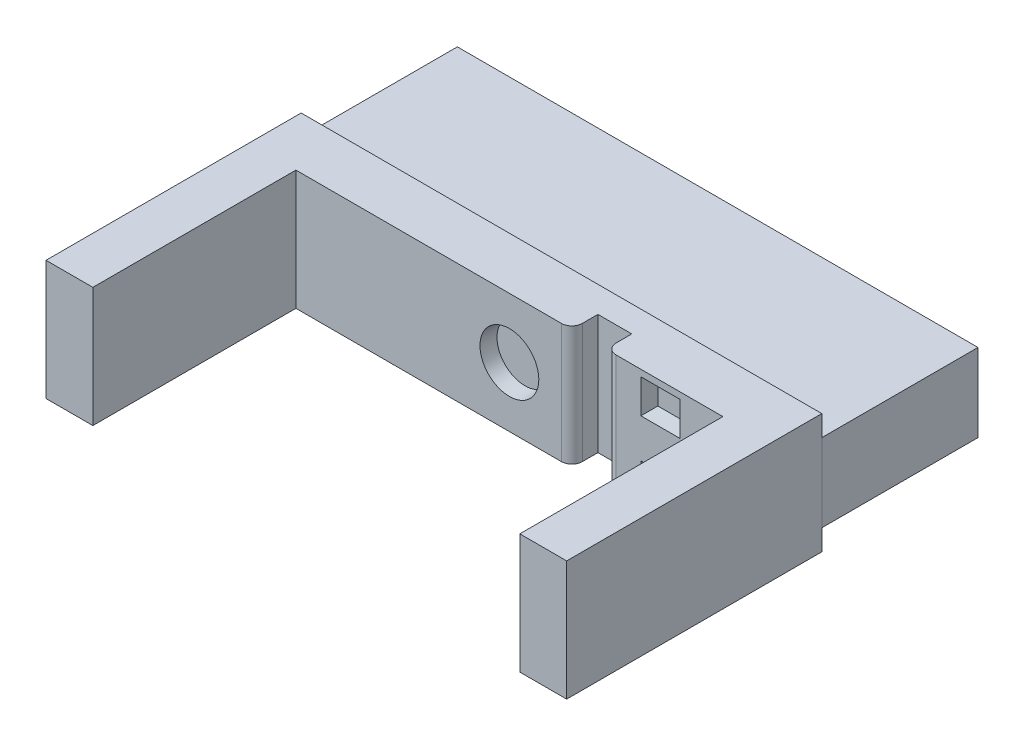
from build123d import *

# Parameters (mm, degrees)
SKETCH1_W                 = 100
SKETCH1_H                 = 15
CARRIAGE_BOTTOM_DEPTH     = 30
SKETCH2_W                 = 100
SKETCH2_H                 = 23
PLEXI_STAND_DEPTH         = 10
SKETCH8_W                 = 6.5
SKETCH8_H                 = 23
HOLE_FOR_WIRES_DEPTH      = 5
FILLET1_R                 = 2
SKETCH9_W                 = 9
SKETCH9_H                 = 23
BRACKET_HOLDERS_DEPTH     = 39
SKETCH10_R                = 5.65
FIT_HOLES_DEPTH           = 3
FIT_HOLES_DRAFT           = -5
SKETCH10_W                = 7.5
SKETCH10_H                = 6.5
FIT_HOLES_PROFILE_2_DEPTH = 3
FIT_HOLES_PROFILE_2_DRAFT = -5
FIT_HOLES_PROFILE_3_DEPTH = 3
FIT_HOLES_PROFILE_3_DRAFT = -5


with BuildPart() as part:
    # Sketch1 → carriage bottom (new body)
    with BuildSketch(Plane.XY):
        with Locations((50, -7.5)):
            Rectangle(SKETCH1_W, SKETCH1_H)
    extrude(amount=CARRIAGE_BOTTOM_DEPTH)


with BuildPart() as body_2:
    # Sketch2 → plexi stand (new body)
    with BuildSketch(Plane.XY.offset(30)):
        with Locations((50, -7.5)):
            Rectangle(SKETCH2_W, SKETCH2_H)
    extrude(amount=PLEXI_STAND_DEPTH)

    # Sketch8 → hole for wires (cut)
    with BuildSketch(Plane.XY.offset(40)):
        with Locations((65.25, -7.5)):
            Rectangle(SKETCH8_W, SKETCH8_H)
    extrude(amount=-HOLE_FOR_WIRES_DEPTH, mode=Mode.SUBTRACT)

    # Fillet1
    fillet1_edges = [body_2.edges().sort_by_distance(p)[0] for p in [
        (68.5, -7.5, 40),
        (62, -7.5, 40),
    ]]
    fillet(fillet1_edges, radius=FILLET1_R)

    # Sketch9 → bracket holders (add)
    with BuildSketch(Plane.XY.offset(40)):
        with Locations((95.5, -7.5)):
            Rectangle(SKETCH9_W, SKETCH9_H)
        with Locations((4.5, -7.5)):
            Rectangle(SKETCH9_W, SKETCH9_H)
    extrude(amount=BRACKET_HOLDERS_DEPTH)


with BuildPart() as fit_holes_tool:
    # Sketch10 → fit holes (with draft: the straight prism first)
    with BuildSketch(Plane.XY.offset(40)):
        with Locations((50, -7.5)):
            Circle(SKETCH10_R)
    extrude(amount=-FIT_HOLES_DEPTH)
    # fit holes: the draft: its side faces are tilted about the plane it starts from
    fit_holes_sides = [fit_holes_tool.faces().sort_by_distance(p)[0] for p in [
        (44.35, -7.5, 38.5),
    ]]
    draft(fit_holes_sides, Plane.XY.offset(40), FIT_HOLES_DRAFT)


with BuildPart() as body_2_1:
    add(body_2.part)

    # fit holes: cut by fit_holes_tool
    add(fit_holes_tool.part, mode=Mode.SUBTRACT)


with BuildPart() as fit_holes_profile_2_tool:
    # Sketch10 → fit holes profile 2 (with draft: the straight prism first)
    with BuildSketch(Plane.XY.offset(40)):
        with Locations((79, -14.5)):
            Rectangle(SKETCH10_W, SKETCH10_H)
    extrude(amount=-FIT_HOLES_PROFILE_2_DEPTH)
    # fit holes profile 2: the draft: its side faces are tilted about the plane it starts from
    fit_holes_profile_2_sides = [fit_holes_profile_2_tool.faces().sort_by_distance(p)[0] for p in [
        (79, -17.75, 38.5),
        (82.75, -14.5, 38.5),
        (79, -11.25, 38.5),
        (75.25, -14.5, 38.5),
    ]]
    draft(fit_holes_profile_2_sides, Plane.XY.offset(40), FIT_HOLES_PROFILE_2_DRAFT)


with BuildPart() as body_2_2:
    add(body_2_1.part)

    # fit holes profile 2: cut by fit_holes_profile_2_tool
    add(fit_holes_profile_2_tool.part, mode=Mode.SUBTRACT)


with BuildPart() as fit_holes_profile_3_tool:
    # Sketch10 → fit holes profile 3 (with draft: the straight prism first)
    with BuildSketch(Plane.XY.offset(40)):
        with Locations((79, -0.5)):
            Rectangle(SKETCH10_W, SKETCH10_H)
    extrude(amount=-FIT_HOLES_PROFILE_3_DEPTH)
    # fit holes profile 3: the draft: its side faces are tilted about the plane it starts from
    fit_holes_profile_3_sides = [fit_holes_profile_3_tool.faces().sort_by_distance(p)[0] for p in [
        (79, -3.75, 38.5),
        (82.75, -0.5, 38.5),
        (79, 2.75, 38.5),
        (75.25, -0.5, 38.5),
    ]]
    draft(fit_holes_profile_3_sides, Plane.XY.offset(40), FIT_HOLES_PROFILE_3_DRAFT)


with BuildPart() as body_2_3:
    add(body_2_2.part)

    # fit holes profile 3: cut by fit_holes_profile_3_tool
    add(fit_holes_profile_3_tool.part, mode=Mode.SUBTRACT)


solid = Compound([part.part, body_2_3.part])
